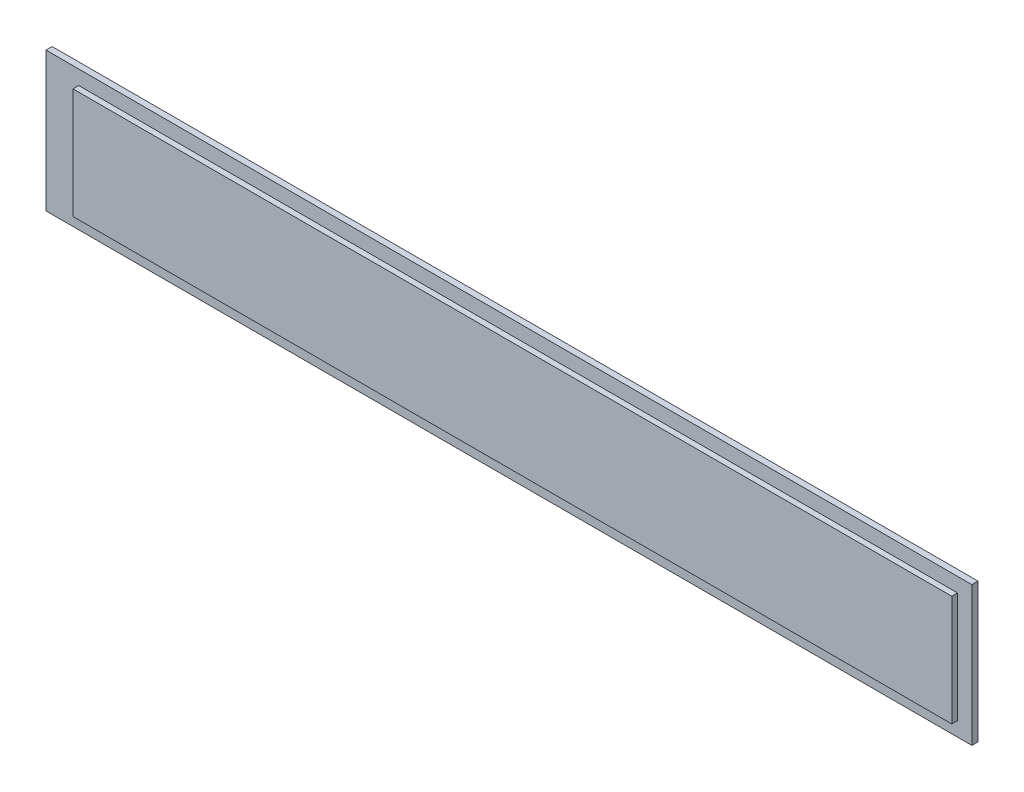
from build123d import *

# Parameters (mm, degrees)
SKETCH_1_W      = 226
SKETCH_1_H      = 34
SKETCH_1_W_2    = 214.5
SKETCH_1_H_2    = 27
EXTRUDE_1_DEPTH = 0.1
SKETCH_2_W      = 226
SKETCH_2_H      = 34
EXTRUDE_2_DEPTH = 1.4
SKETCH_3_W      = 214.5
SKETCH_3_H      = 27
EXTRUDE_3_DEPTH = 1.5


with BuildPart() as part:
    # Эскиз1 → Бобышка-Вытянуть1 (new body)
    with BuildSketch(Plane.XY):
        with Locations((108, 4.1)):
            Rectangle(SKETCH_1_W, SKETCH_1_H)
        with Locations((110.25, 4.1)):
            Rectangle(SKETCH_1_W_2, SKETCH_1_H_2, mode=Mode.SUBTRACT)
    extrude(amount=EXTRUDE_1_DEPTH)

    # Эскиз2 → Бобышка-Вытянуть2 (add)
    with BuildSketch(Plane(origin=(0, 0, 0), x_dir=(-1, 0, 0), z_dir=(0, 0, -1))):
        with Locations((-108, 4.1)):
            Rectangle(SKETCH_2_W, SKETCH_2_H)
    extrude(amount=EXTRUDE_2_DEPTH)

    # Эскиз3 → Бобышка-Вытянуть3 (add)
    with BuildSketch(Plane.XY):
        with Locations((110.25, 4.1)):
            Rectangle(SKETCH_3_W, SKETCH_3_H)
    extrude(amount=EXTRUDE_3_DEPTH)


solid = part.part
